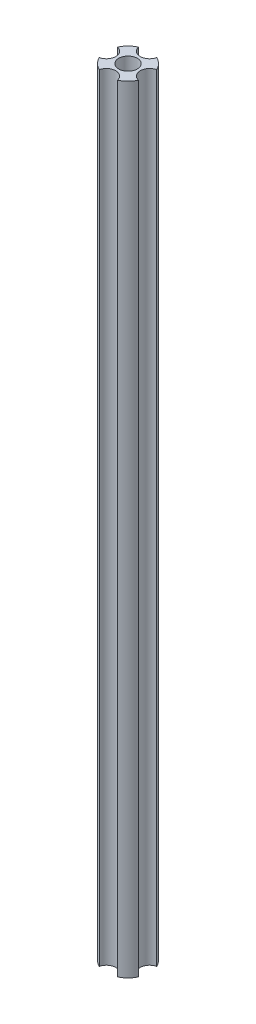
from build123d import *

# Parameters (mm, degrees)
SKETCH1_R           = 1.5
BOSS_EXTRUDE1_DEPTH = 125


with BuildPart() as part:
    # Sketch1 → Boss-Extrude1 (new body)
    with BuildSketch(Plane(origin=(0, 0, 0), x_dir=(1, 0, 0), z_dir=(0, 1, 0))):
        with BuildLine():
            ThreePointArc((-3.151258993, -1.464647316), (-2.457196065, -2.457196065), (-1.464647316, -3.151258993))
            ThreePointArc((-1.464647316, -3.151258993), (0, -1.975), (1.464647316, -3.151258993))
            ThreePointArc((1.464647316, -3.151258993), (2.457196065, -2.457196065), (3.151258993, -1.464647316))
            ThreePointArc((3.151258993, -1.464647316), (1.975, 0), (3.151258993, 1.464647316))
            ThreePointArc((3.151258993, 1.464647316), (2.457196065, 2.457196065), (1.464647316, 3.151258993))
            ThreePointArc((1.464647316, 3.151258993), (0, 1.975), (-1.464647316, 3.151258993))
            ThreePointArc((-1.464647316, 3.151258993), (-2.457196065, 2.457196065), (-3.151258993, 1.464647316))
            ThreePointArc((-3.151258993, 1.464647316), (-1.975, 0), (-3.151258993, -1.464647316))
        make_face()
        with Locations(Location((0, 0, 0), (0, 0, 270))):
            Circle(SKETCH1_R, mode=Mode.SUBTRACT)
    extrude(amount=BOSS_EXTRUDE1_DEPTH)


solid = part.part
